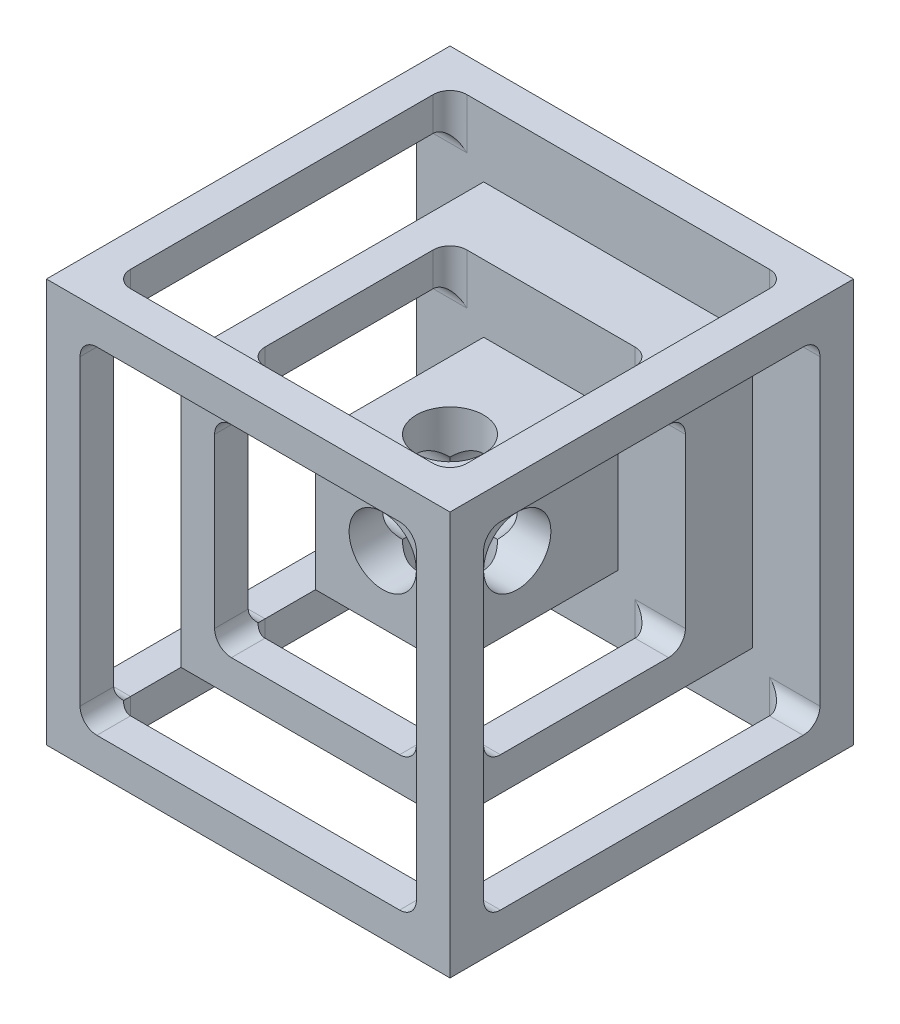
from build123d import *

# Parameters (mm, degrees)
SKETCH1_W           = 152.4
SKETCH1_H           = 152.4
EXTRUDE2_DEPTH      = 152.4
CUT_EXTRUDE14_DEPTH = 25.4
CUT_EXTRUDE18_DEPTH = 25.4
CUT_EXTRUDE19_DEPTH = 25.4
CUT_EXTRUDE21_START = -25.4
CUT_EXTRUDE21_DEPTH = 25.4
CUT_EXTRUDE22_START = -25.4
CUT_EXTRUDE22_DEPTH = 25.4
CUT_EXTRUDE24_DEPTH = 25.4
CUT_EXTRUDE27_DEPTH = 25.4
CUT_EXTRUDE28_START = -25.4
CUT_EXTRUDE28_DEPTH = 25.4
CUT_EXTRUDE29_DEPTH = 25.4
CUT_EXTRUDE30_START = -25.4
CUT_EXTRUDE30_DEPTH = 25.4
SKETCH30_R          = 12.7
CUT_EXTRUDE31_DEPTH = 239.273120599
SKETCH31_R          = 12.7
CUT_EXTRUDE32_DEPTH = 239.273120599
SKETCH32_R          = 12.7
CUT_EXTRUDE33_DEPTH = 239.273120599
SCALE1_SCALE        = 2


with BuildPart() as part:
    # Sketch1 → Extrude2 (new body)
    with BuildSketch(Plane(origin=(0, 0, 0), x_dir=(1, 0, 0), z_dir=(0, 1, 0))):
        with Locations((76.2, 76.2)):
            Rectangle(SKETCH1_W, SKETCH1_H)
    extrude(amount=EXTRUDE2_DEPTH)

    # Sketch13 → Cut-Extrude14 (cut)
    with BuildSketch(Plane(origin=(0, 152.4, 0), x_dir=(1, 0, 0), z_dir=(0, 1, 0))):
        with BuildLine():
            Line((19.05, 12.7), (133.35, 12.7))
            ThreePointArc((133.35, 12.7), (137.840128061, 14.559871939), (139.7, 19.05))
            Line((139.7, 19.05), (139.7, 133.35))
            ThreePointArc((139.7, 133.35), (137.840128061, 137.840128061), (133.35, 139.7))
            Line((133.35, 139.7), (19.05, 139.7))
            ThreePointArc((19.05, 139.7), (14.559871939, 137.840128061), (12.7, 133.35))
            Line((12.7, 133.35), (12.7, 19.05))
            ThreePointArc((12.7, 19.05), (14.559871939, 14.559871939), (19.05, 12.7))
        make_face()
    extrude(amount=-CUT_EXTRUDE14_DEPTH, mode=Mode.SUBTRACT)

    # Sketch17 → Cut-Extrude18 (cut)
    with BuildSketch(Plane.XY):
        with BuildLine():
            Line((19.05, 12.7), (133.35, 12.7))
            ThreePointArc((133.35, 12.7), (137.840128061, 14.559871939), (139.7, 19.05))
            Line((139.7, 19.05), (139.7, 133.35))
            ThreePointArc((139.7, 133.35), (137.840128061, 137.840128061), (133.35, 139.7))
            Line((133.35, 139.7), (19.05, 139.7))
            ThreePointArc((19.05, 139.7), (14.559871939, 137.840128061), (12.7, 133.35))
            Line((12.7, 133.35), (12.7, 19.05))
            ThreePointArc((12.7, 19.05), (14.559871939, 14.559871939), (19.05, 12.7))
        make_face()
    extrude(amount=-CUT_EXTRUDE18_DEPTH, mode=Mode.SUBTRACT)

    # Sketch18 → Cut-Extrude19 (cut)
    with BuildSketch(Plane(origin=(152.4, 0, 0), x_dir=(0, 0, -1), z_dir=(1, 0, 0))):
        with BuildLine():
            Line((19.05, 12.7), (133.35, 12.7))
            ThreePointArc((133.35, 12.7), (137.840128061, 14.559871939), (139.7, 19.05))
            Line((139.7, 19.05), (139.7, 133.35))
            ThreePointArc((139.7, 133.35), (137.840128061, 137.840128061), (133.35, 139.7))
            Line((133.35, 139.7), (19.05, 139.7))
            ThreePointArc((19.05, 139.7), (14.559871939, 137.840128061), (12.7, 133.35))
            Line((12.7, 133.35), (12.7, 19.05))
            ThreePointArc((12.7, 19.05), (14.559871939, 14.559871939), (19.05, 12.7))
        make_face()
    extrude(amount=-CUT_EXTRUDE19_DEPTH, mode=Mode.SUBTRACT)

    # Sketch20 → Cut-Extrude21 (cut)
    with BuildSketch(Plane.ZY.offset(CUT_EXTRUDE21_START)):
        with BuildLine():
            Line((-133.35, 12.7), (-19.05, 12.7))
            ThreePointArc((-19.05, 12.7), (-14.559871939, 14.559871939), (-12.7, 19.05))
            Line((-12.7, 19.05), (-12.7, 133.35))
            ThreePointArc((-12.7, 133.35), (-14.559871939, 137.840128061), (-19.05, 139.7))
            Line((-19.05, 139.7), (-133.35, 139.7))
            ThreePointArc((-133.35, 139.7), (-137.840128061, 137.840128061), (-139.7, 133.35))
            Line((-139.7, 133.35), (-139.7, 19.05))
            ThreePointArc((-139.7, 19.05), (-137.840128061, 14.559871939), (-133.35, 12.7))
        make_face()
    extrude(amount=CUT_EXTRUDE21_DEPTH, mode=Mode.SUBTRACT)

    # Sketch21 → Cut-Extrude22 (cut)
    with BuildSketch(Plane.XZ.offset(CUT_EXTRUDE22_START)):
        with BuildLine():
            Line((19.05, -139.7), (133.35, -139.7))
            ThreePointArc((133.35, -139.7), (137.840128061, -137.840128061), (139.7, -133.35))
            Line((139.7, -133.35), (139.7, -19.05))
            ThreePointArc((139.7, -19.05), (137.840128061, -14.559871939), (133.35, -12.7))
            Line((133.35, -12.7), (19.05, -12.7))
            ThreePointArc((19.05, -12.7), (14.559871939, -14.559871939), (12.7, -19.05))
            Line((12.7, -19.05), (12.7, -133.35))
            ThreePointArc((12.7, -133.35), (14.559871939, -137.840128061), (19.05, -139.7))
        make_face()
    extrude(amount=CUT_EXTRUDE22_DEPTH, mode=Mode.SUBTRACT)

    # Sketch23 → Cut-Extrude24 (cut)
    with BuildSketch(Plane.XY.offset(-25.4)):
        with BuildLine():
            Line((44.45, 38.1), (107.95, 38.1))
            ThreePointArc((107.95, 38.1), (112.440128061, 39.959871939), (114.3, 44.45))
            Line((114.3, 44.45), (114.3, 107.95))
            ThreePointArc((114.3, 107.95), (112.440128061, 112.440128061), (107.95, 114.3))
            Line((107.95, 114.3), (44.45, 114.3))
            ThreePointArc((44.45, 114.3), (39.959871939, 112.440128061), (38.1, 107.95))
            Line((38.1, 107.95), (38.1, 44.45))
            ThreePointArc((38.1, 44.45), (39.959871939, 39.959871939), (44.45, 38.1))
        make_face()
    extrude(amount=-CUT_EXTRUDE24_DEPTH, mode=Mode.SUBTRACT)

    # Sketch26 → Cut-Extrude27 (cut)
    with BuildSketch(Plane.XZ.offset(-25.4)):
        with BuildLine():
            Line((44.45, -114.3), (107.95, -114.3))
            ThreePointArc((107.95, -114.3), (112.440128061, -112.440128061), (114.3, -107.95))
            Line((114.3, -107.95), (114.3, -44.45))
            ThreePointArc((114.3, -44.45), (112.440128061, -39.959871939), (107.95, -38.1))
            Line((107.95, -38.1), (44.45, -38.1))
            ThreePointArc((44.45, -38.1), (39.959871939, -39.959871939), (38.1, -44.45))
            Line((38.1, -44.45), (38.1, -107.95))
            ThreePointArc((38.1, -107.95), (39.959871939, -112.440128061), (44.45, -114.3))
        make_face()
    extrude(amount=-CUT_EXTRUDE27_DEPTH, mode=Mode.SUBTRACT)

    # Sketch27 → Cut-Extrude28 (cut)
    with BuildSketch(Plane(origin=(0, 127, 0), x_dir=(-1, 0, 0), z_dir=(0, 1, 0)).offset(CUT_EXTRUDE28_START)):
        with BuildLine():
            Line((-107.95, -114.3), (-44.45, -114.3))
            ThreePointArc((-44.45, -114.3), (-39.959871939, -112.440128061), (-38.1, -107.95))
            Line((-38.1, -107.95), (-38.1, -44.45))
            ThreePointArc((-38.1, -44.45), (-39.959871939, -39.959871939), (-44.45, -38.1))
            Line((-44.45, -38.1), (-107.95, -38.1))
            ThreePointArc((-107.95, -38.1), (-112.440128061, -39.959871939), (-114.3, -44.45))
            Line((-114.3, -44.45), (-114.3, -107.95))
            ThreePointArc((-114.3, -107.95), (-112.440128061, -112.440128061), (-107.95, -114.3))
        make_face()
    extrude(amount=CUT_EXTRUDE28_DEPTH, mode=Mode.SUBTRACT)

    # Sketch28 → Cut-Extrude29 (cut)
    with BuildSketch(Plane(origin=(25.4, 0, 0), x_dir=(0, -1, 0), z_dir=(-1, 0, 0))):
        with BuildLine():
            Line((-107.95, -114.3), (-44.45, -114.3))
            ThreePointArc((-44.45, -114.3), (-39.959871939, -112.440128061), (-38.1, -107.95))
            Line((-38.1, -107.95), (-38.1, -44.45))
            ThreePointArc((-38.1, -44.45), (-39.959871939, -39.959871939), (-44.45, -38.1))
            Line((-44.45, -38.1), (-107.95, -38.1))
            ThreePointArc((-107.95, -38.1), (-112.440128061, -39.959871939), (-114.3, -44.45))
            Line((-114.3, -44.45), (-114.3, -107.95))
            ThreePointArc((-114.3, -107.95), (-112.440128061, -112.440128061), (-107.95, -114.3))
        make_face()
    extrude(amount=-CUT_EXTRUDE29_DEPTH, mode=Mode.SUBTRACT)

    # Sketch29 → Cut-Extrude30 (cut)
    with BuildSketch(Plane.YZ.offset(127).offset(CUT_EXTRUDE30_START)):
        with BuildLine():
            Line((44.45, -114.3), (107.95, -114.3))
            ThreePointArc((107.95, -114.3), (112.440128061, -112.440128061), (114.3, -107.95))
            Line((114.3, -107.95), (114.3, -44.45))
            ThreePointArc((114.3, -44.45), (112.440128061, -39.959871939), (107.95, -38.1))
            Line((107.95, -38.1), (44.45, -38.1))
            ThreePointArc((44.45, -38.1), (39.959871939, -39.959871939), (38.1, -44.45))
            Line((38.1, -44.45), (38.1, -107.95))
            ThreePointArc((38.1, -107.95), (39.959871939, -112.440128061), (44.45, -114.3))
        make_face()
    extrude(amount=CUT_EXTRUDE30_DEPTH, mode=Mode.SUBTRACT)

    # Sketch30 → Cut-Extrude31 (cut, through all)
    with BuildSketch(Plane.XY.offset(-50.8)):
        with Locations((76.2, 76.2)):
            Circle(SKETCH30_R)
    extrude(amount=-CUT_EXTRUDE31_DEPTH, mode=Mode.SUBTRACT)

    # Sketch31 → Cut-Extrude32 (cut, through all)
    with BuildSketch(Plane(origin=(101.6, 0, 0), x_dir=(0, 0, -1), z_dir=(1, 0, 0))):
        with Locations((76.2, 76.2)):
            Circle(SKETCH31_R)
    extrude(amount=-CUT_EXTRUDE32_DEPTH, mode=Mode.SUBTRACT)

    # Sketch32 → Cut-Extrude33 (cut, through all)
    with BuildSketch(Plane.XZ.offset(-50.8)):
        with Locations(Location((76.2, -76.2, 0), (0, 0, 225))):
            Circle(SKETCH32_R)
    extrude(amount=-CUT_EXTRUDE33_DEPTH, mode=Mode.SUBTRACT)


with BuildPart() as part_1:
    # Scale1: scaled about (76.199999991, 76.199999991, -102.985994001)
    add(part.part.scale(SCALE1_SCALE).moved(Location((-76.199999991, -76.199999991, 102.985994001))))


solid = part_1.part
